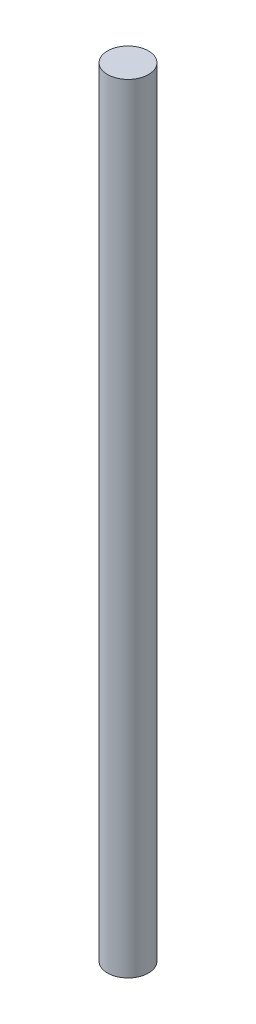
from build123d import *

# Parameters (mm, degrees)
SKETCH1_R           = 1.5875
BOSS_EXTRUDE1_DEPTH = 60.325


with BuildPart() as part:
    # Sketch1 → Boss-Extrude1 (new body)
    with BuildSketch(Plane(origin=(0, 0, 0), x_dir=(1, 0, 0), z_dir=(0, 1, 0))):
        with Locations(Location((-41.164795015, -11.440642282, 0), (0, 0, 90))):
            Circle(SKETCH1_R)
    extrude(amount=BOSS_EXTRUDE1_DEPTH)


solid = part.part
